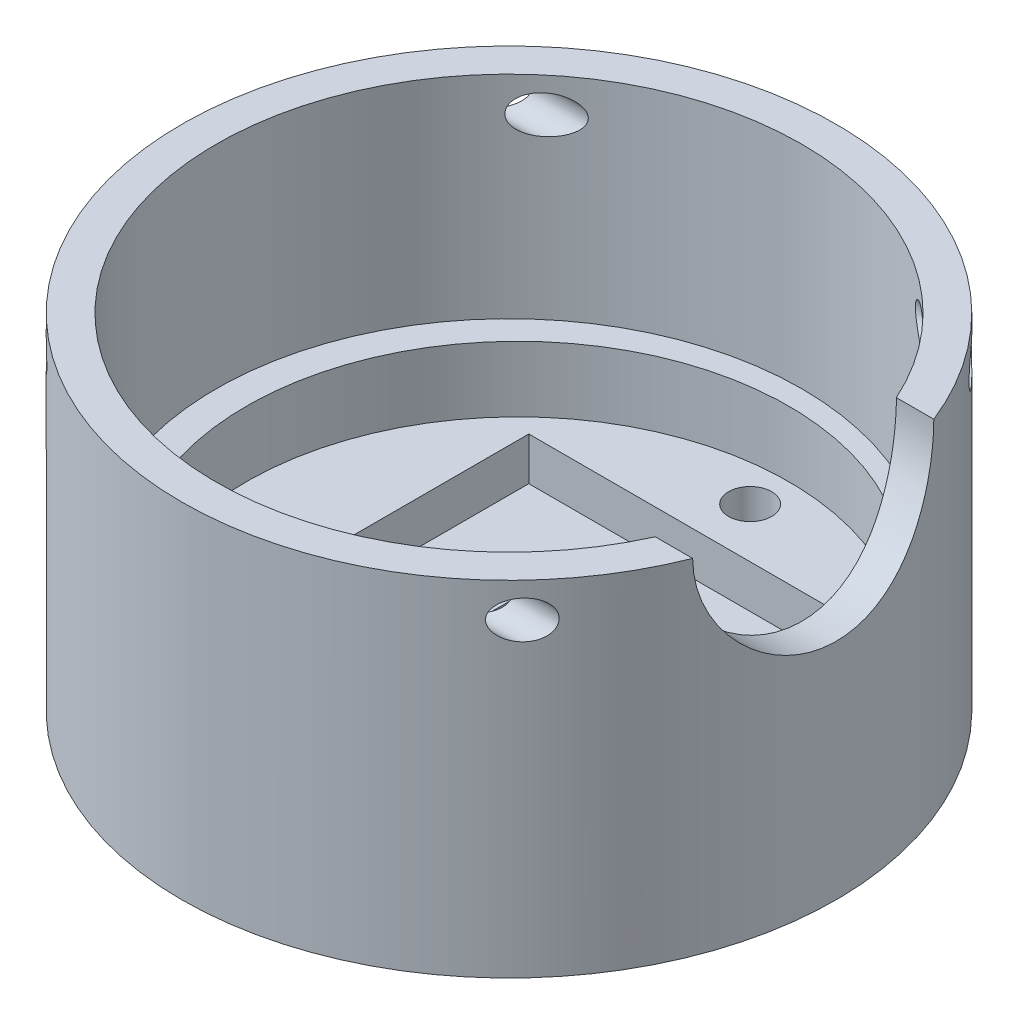
from build123d import *

# Parameters (mm, degrees)
SKETCH3_R                            = 19
MAIN_BODY_DEPTH                      = 20
CUT_START                            = -7.7
SKETCH5_R                            = 17
CUT_FOR_HEADERS_DEPTH                = 26.796268449
CUT_FOR_ADNS_WIRES_REACH             = 35.496
SKETCH7_R                            = 7
SKETCH8_R                            = 15.75
CUT_FOR_PCB_DEPTH                    = 3.8
SKETCH9_R                            = 1.25
CUT_FOR_SCREW_HOLES_DEPTH            = 5
SKETCH10_W                           = 18.9
SKETCH10_H                           = 21.2
CUT_FOR_LENS_DEPTH                   = 2.5
CUT_FOR_PUPIL_REACH                  = 34.68
SKETCH11_W                           = 8.2
SKETCH11_H                           = 10.2
CUTS_FOR_BODY_SCREW_HOLES_DEPTH      = 34.496268622
CUTS_FOR_BODY_SCREW_HOLES_DEPTH_BACK = 34.496268622
SKETCH13_R                           = 1.1


with BuildPart() as part:
    # Sketch3 → Main Body (new body)
    with BuildSketch(Plane(origin=(0, 0, 0), x_dir=(1, 0, 0), z_dir=(0, 1, 0))):
        Circle(SKETCH3_R)
    extrude(amount=-MAIN_BODY_DEPTH)

    # Sketch5 → Cut for Headers (cut, through all)
    with BuildSketch(Plane.XZ.offset(20).offset(CUT_START)):
        Circle(SKETCH5_R)
    extrude(amount=-CUT_FOR_HEADERS_DEPTH, mode=Mode.SUBTRACT)

    # Sketch7 → Cut for ADNS Wires (cut, up to next)
    with BuildSketch(Plane(origin=(0, 0, 0), x_dir=(0, 0, -1), z_dir=(1, 0, 0)), mode=Mode.PRIVATE) as cut_for_adns_wires_sk1:
        Circle(SKETCH7_R)
    cut_for_adns_wires_tool1 = extrude(cut_for_adns_wires_sk1.sketch, amount=CUT_FOR_ADNS_WIRES_REACH, mode=Mode.PRIVATE) & part.part
    add(cut_for_adns_wires_tool1.solids().sort_by_distance((0, 0, 0))[0], mode=Mode.SUBTRACT)

    # Sketch8 → Cut for PCB (cut)
    with BuildSketch(Plane(origin=(0, -12.3, 0), x_dir=(1, 0, 0), z_dir=(0, 1, 0))):
        with Locations((0.5, 0)):
            Circle(SKETCH8_R)
    extrude(amount=-CUT_FOR_PCB_DEPTH, mode=Mode.SUBTRACT)

    # Sketch9 → Cut for Screw Holes (cut)
    with BuildSketch(Plane(origin=(0, -16.1, 0), x_dir=(1, 0, 0), z_dir=(0, 1, 0))):
        with Locations((0.5, 13.5)):
            Circle(SKETCH9_R)
        with Locations((0.5, -13.5)):
            Circle(SKETCH9_R)
    extrude(amount=-CUT_FOR_SCREW_HOLES_DEPTH, mode=Mode.SUBTRACT)

    # Sketch10 → Cut for Lens (cut)
    with BuildSketch(Plane(origin=(0, -16.1, 0), x_dir=(1, 0, 0), z_dir=(0, 1, 0))):
        Rectangle(SKETCH10_W, SKETCH10_H)
    extrude(amount=-CUT_FOR_LENS_DEPTH, mode=Mode.SUBTRACT)

    # Sketch11 → Cut for Pupil (cut, up to next)
    with BuildSketch(Plane(origin=(0, -18.6, 0), x_dir=(1, 0, 0), z_dir=(0, 1, 0)), mode=Mode.PRIVATE) as cut_for_pupil_sk1:
        Rectangle(SKETCH11_W, SKETCH11_H)
    cut_for_pupil_tool1 = extrude(cut_for_pupil_sk1.sketch, amount=-CUT_FOR_PUPIL_REACH, mode=Mode.PRIVATE) & part.part
    add(cut_for_pupil_tool1.solids().sort_by_distance((0, -18.6, 0))[0], mode=Mode.SUBTRACT)

    # Sketch13 → Cuts for Body Screw Holes (cut, two sides: drawn at the far end of the back side and taken through both)
    with BuildSketch(Plane(origin=(0, 0, 0), x_dir=(0, 0, -1), z_dir=(1, 0, 0)).offset(-CUTS_FOR_BODY_SCREW_HOLES_DEPTH_BACK)):
        with Locations((13, -2)):
            Circle(SKETCH13_R)
        with Locations((-13, -2)):
            Circle(SKETCH13_R)
    extrude(amount=CUTS_FOR_BODY_SCREW_HOLES_DEPTH + CUTS_FOR_BODY_SCREW_HOLES_DEPTH_BACK, mode=Mode.SUBTRACT)


solid = part.part
